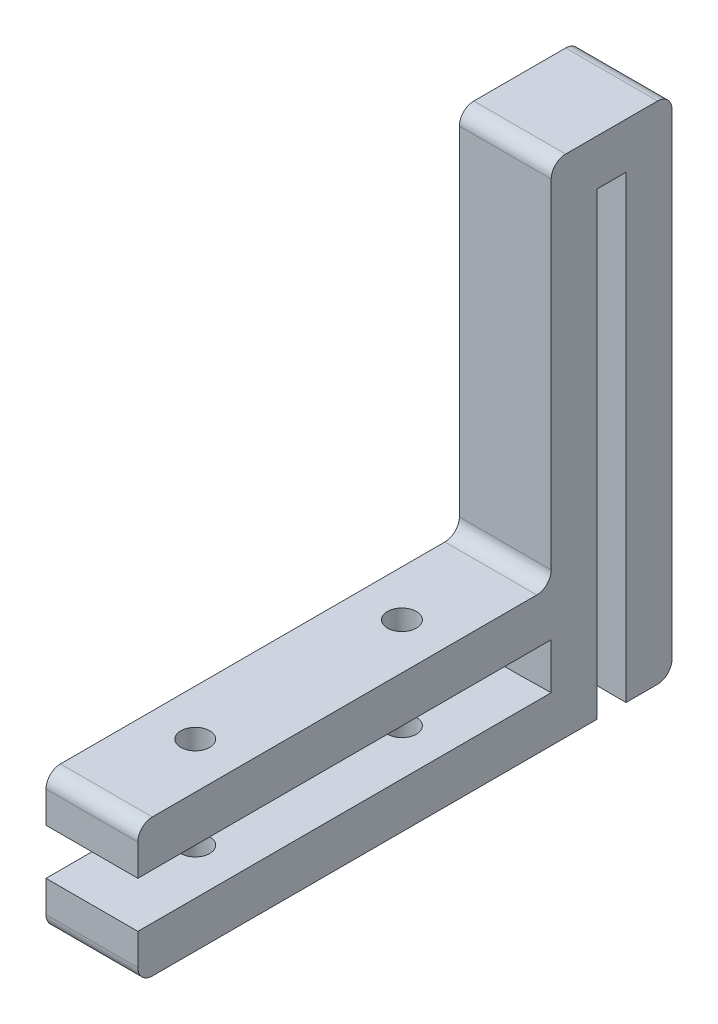
from build123d import *

# Parameters (mm, degrees)
SKETCH1_W           = 12.7
SKETCH1_H           = 63.5
BOSS_EXTRUDE1_DEPTH = 6.35
SKETCH2_W           = 12.7
SKETCH2_H           = 6.35
BOSS_EXTRUDE2_DEPTH = 6.35
SKETCH3_W           = 12.7
SKETCH3_H           = 63.5
BOSS_EXTRUDE3_DEPTH = 6.35
SKETCH4_W           = 12.7
SKETCH4_H           = 6.35
BOSS_EXTRUDE4_DEPTH = 50.8
SKETCH5_W           = 12.7
SKETCH5_H           = 6.35
BOSS_EXTRUDE5_DEPTH = 4
SKETCH6_W           = 12.7
SKETCH6_H           = 69.85
BOSS_EXTRUDE6_DEPTH = 6.35
BOSS_EXTRUDE7_DEPTH = 6.35
SKETCH9_R           = 2
CUT_EXTRUDE1_DEPTH  = 91.530395448
FILLET1_R           = 2
FILLET2_R           = 2


with BuildPart() as part:
    # Sketch1 → Boss-Extrude1 (new body)
    with BuildSketch(Plane(origin=(0, 0, 0), x_dir=(1, 0, 0), z_dir=(0, 1, 0))):
        with Locations((6.35, 31.75)):
            Rectangle(SKETCH1_W, SKETCH1_H)
    extrude(amount=BOSS_EXTRUDE1_DEPTH)

    # Sketch2 → Boss-Extrude2 (add)
    with BuildSketch(Plane(origin=(0, 6.35, 0), x_dir=(1, 0, 0), z_dir=(0, 1, 0))):
        with Locations((6.35, 60.325)):
            Rectangle(SKETCH2_W, SKETCH2_H)
    extrude(amount=BOSS_EXTRUDE2_DEPTH)

    # Sketch3 → Boss-Extrude3 (add)
    with BuildSketch(Plane(origin=(0, 12.7, 0), x_dir=(1, 0, 0), z_dir=(0, 1, 0))):
        with Locations((6.35, 31.75)):
            Rectangle(SKETCH3_W, SKETCH3_H)
    extrude(amount=BOSS_EXTRUDE3_DEPTH)

    # Sketch4 → Boss-Extrude4 (add)
    with BuildSketch(Plane(origin=(0, 19.05, 0), x_dir=(1, 0, 0), z_dir=(0, 1, 0))):
        with Locations((6.35, 60.325)):
            Rectangle(SKETCH4_W, SKETCH4_H)
    extrude(amount=BOSS_EXTRUDE4_DEPTH)

    # Sketch5 → Boss-Extrude5 (add)
    with BuildSketch(Plane(origin=(0, 0, -63.5), x_dir=(-1, 0, 0), z_dir=(0, 0, -1))):
        with Locations((-6.35, 66.675)):
            Rectangle(SKETCH5_W, SKETCH5_H)
    extrude(amount=BOSS_EXTRUDE5_DEPTH)

    # Sketch6 → Boss-Extrude6 (add)
    with BuildSketch(Plane(origin=(0, 0, -67.5), x_dir=(-1, 0, 0), z_dir=(0, 0, -1))):
        with Locations((-6.35, 34.925)):
            Rectangle(SKETCH6_W, SKETCH6_H)
    extrude(amount=BOSS_EXTRUDE6_DEPTH)

    # Sketch7 → Boss-Extrude7 (add)
    with BuildSketch(Plane(origin=(0, 6.35, 0), x_dir=(1, 0, 0), z_dir=(0, 1, 0))):
        with BuildLine():
            Line((12.7, 57.15), (0, 57.15))
            ThreePointArc((0, 57.15), (6.35, 57.059267194), (12.7, 57.15))
        make_face()
    extrude(amount=BOSS_EXTRUDE7_DEPTH)

    # Sketch9 → Cut-Extrude1 (cut, through all)
    with BuildSketch(Plane(origin=(0, 19.05, 0), x_dir=(1, 0, 0), z_dir=(0, 1, 0))):
        with Locations(Location((6.35, 42.8625, 0), (0, 0, 270))):
            Circle(SKETCH9_R)
        with Locations(Location((6.35, 14.2875, 0), (0, 0, 270))):
            Circle(SKETCH9_R)
    extrude(amount=-CUT_EXTRUDE1_DEPTH, mode=Mode.SUBTRACT)

    # Fillet1
    fillet1_edges = [part.edges().sort_by_distance(p)[0] for p in [
        (6.35, 19.05, 0),
        (6.35, 69.85, -57.15),
        (6.35, 0, 0),
        (6.35, 0, -73.85),
        (6.35, 69.85, -73.85),
    ]]
    fillet(fillet1_edges, radius=FILLET1_R)

    # Fillet2
    fillet2_edges = [part.edges().sort_by_distance(p)[0] for p in [
        (6.35, 19.05, -57.15),
    ]]
    fillet(fillet2_edges, radius=FILLET2_R)


solid = part.part
